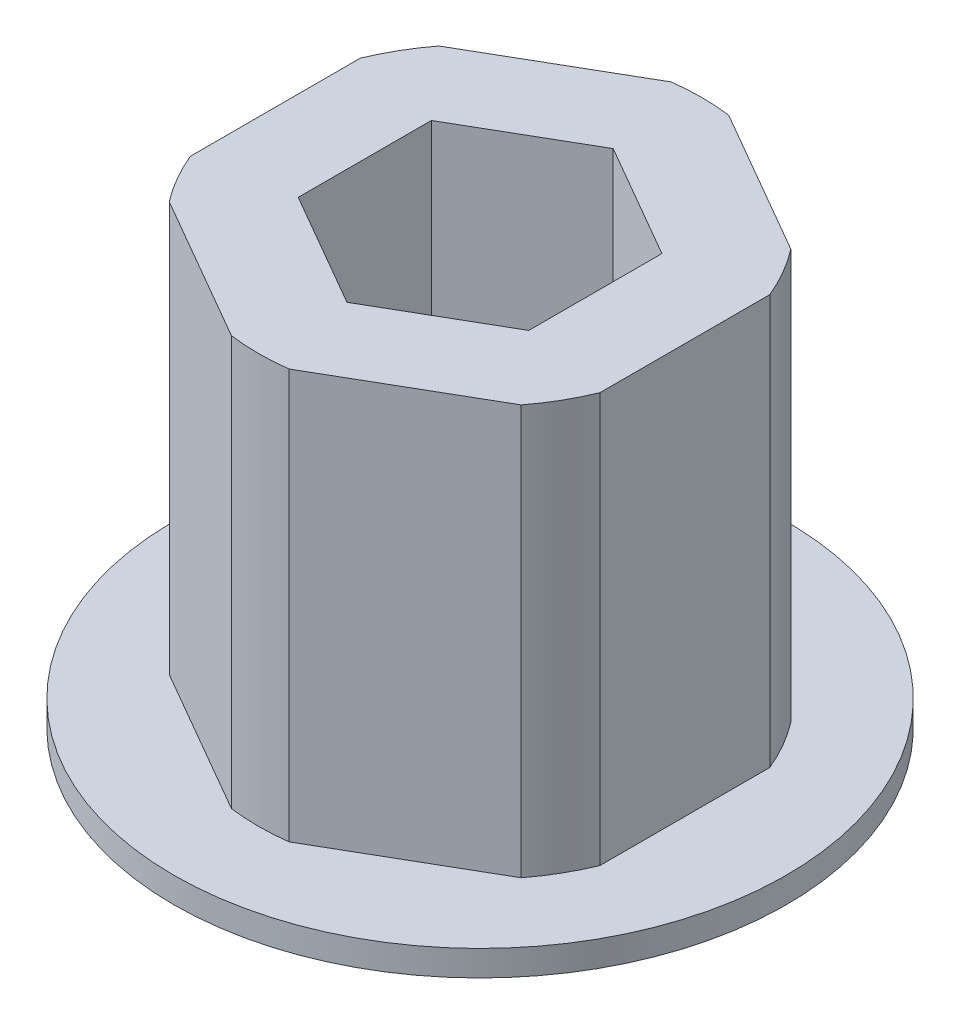
from build123d import *

# Parameters (mm, degrees)
SKETCH1_R           = 9.5
BOSS_EXTRUDE1_DEPTH = 0.79375
BOSS_EXTRUDE2_DEPTH = 12.7


with BuildPart() as part:
    # Sketch1 → Boss-Extrude1 (new body)
    with BuildSketch(Plane(origin=(0, 0, 0), x_dir=(1, 0, 0), z_dir=(0, 1, 0))):
        with Locations(Location((0, 0, 0), (0, 0, 270))):
            Circle(SKETCH1_R)
        Polygon((0, 4.128054425), (-3.575, 2.064027212), (-3.575, -2.064027212), (0, -4.128054425), (3.575, -2.064027212), (3.575, 2.064027212), align=None, mode=Mode.SUBTRACT)
    extrude(amount=BOSS_EXTRUDE1_DEPTH)

    # Sketch2 → Boss-Extrude2 (add)
    with BuildSketch(Plane(origin=(0, 0.79375, 0), x_dir=(1, 0, 0), z_dir=(0, 1, 0))):
        with BuildLine():
            ThreePointArc((0.893039494, 6.816751826), (0, 6.875), (-0.893039494, 6.816751826))
            Line((-0.893039494, 6.816751826), (-5.456960506, 4.181770802))
            ThreePointArc((-5.456960506, 4.181770802), (-5.953924651, 3.4375), (-6.35, 2.634981025))
            Line((-6.35, 2.634981025), (-6.35, -2.634981025))
            ThreePointArc((-6.35, -2.634981025), (-5.953924651, -3.4375), (-5.456960506, -4.181770802))
            Line((-5.456960506, -4.181770802), (-0.893039494, -6.816751826))
            ThreePointArc((-0.893039494, -6.816751826), (0, -6.875), (0.893039494, -6.816751826))
            Line((0.893039494, -6.816751826), (5.456960506, -4.181770802))
            ThreePointArc((5.456960506, -4.181770802), (5.953924651, -3.4375), (6.35, -2.634981025))
            Line((6.35, -2.634981025), (6.35, 2.634981025))
            ThreePointArc((6.35, 2.634981025), (5.953924651, 3.4375), (5.456960506, 4.181770802))
            Line((5.456960506, 4.181770802), (0.893039494, 6.816751826))
        make_face()
        Polygon((-3.575, 2.064027212), (0, 4.128054425), (3.575, 2.064027212), (3.575, -2.064027212), (0, -4.128054425), (-3.575, -2.064027212), align=None, mode=Mode.SUBTRACT)
    extrude(amount=BOSS_EXTRUDE2_DEPTH)


solid = part.part
